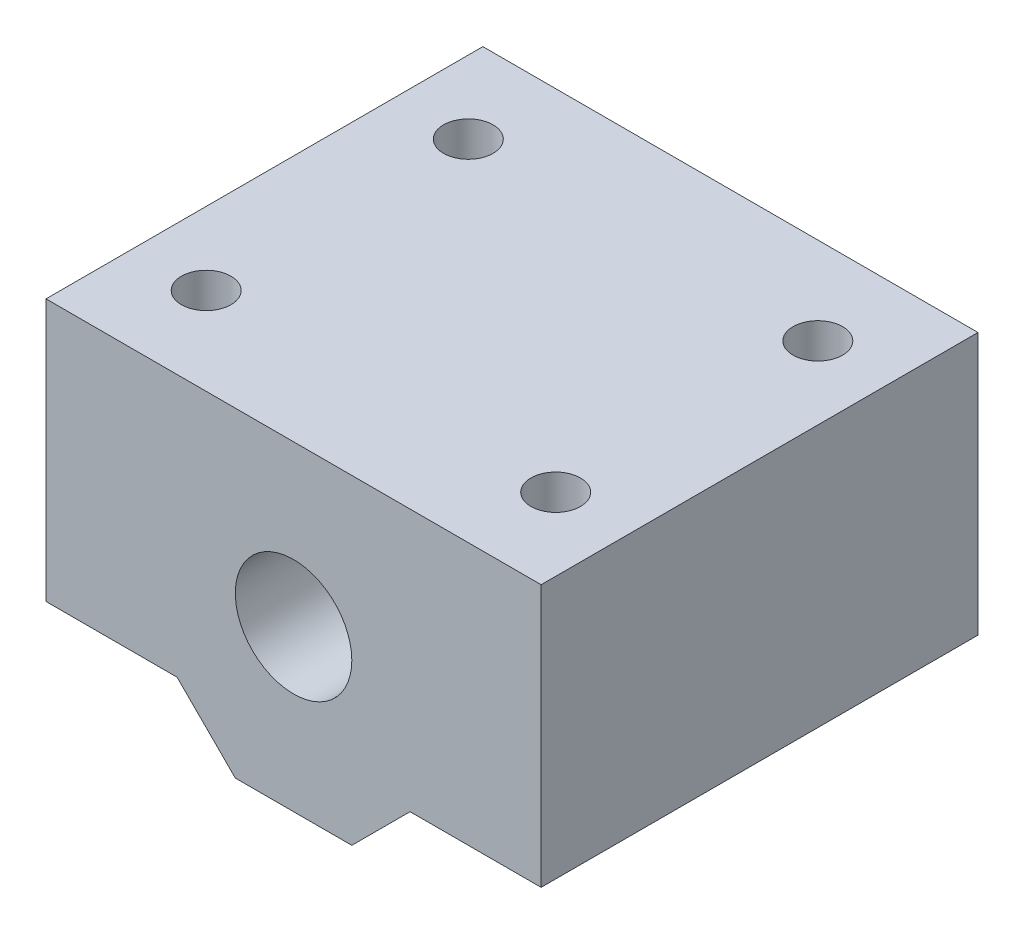
from build123d import *

# Parameters (mm, degrees)
SKETCH_1_R          = 4
EXTRUDE_1_DEPTH     = 30
SKETCH_2_R          = 1.7
CUT_EXTRUDE_1_DEPTH = 20


with BuildPart() as part:
    # 草图1 → 凸台-拉伸1 (new body)
    with BuildSketch(Plane.XY):
        Polygon((-17, -7), (-8, -7), (-4, -11), (4, -11), (8, -7), (17, -7), (17, 11), (-17, 11), align=None)
        Circle(SKETCH_1_R, mode=Mode.SUBTRACT)
    extrude(amount=EXTRUDE_1_DEPTH)

    # 草图2 → 切除-拉伸1 (cut)
    with BuildSketch(Plane.XZ.offset(7)):
        with Locations(Location((-12, 24, 0), (0, 0, 270))):
            Circle(SKETCH_2_R)
        with Locations(Location((-12, 6, 0), (0, 0, 270))):
            Circle(SKETCH_2_R)
        with Locations(Location((12, 24, 0), (0, 0, 270))):
            Circle(SKETCH_2_R)
        with Locations(Location((12, 6, 0), (0, 0, 270))):
            Circle(SKETCH_2_R)
    extrude(amount=-CUT_EXTRUDE_1_DEPTH, mode=Mode.SUBTRACT)


solid = part.part
